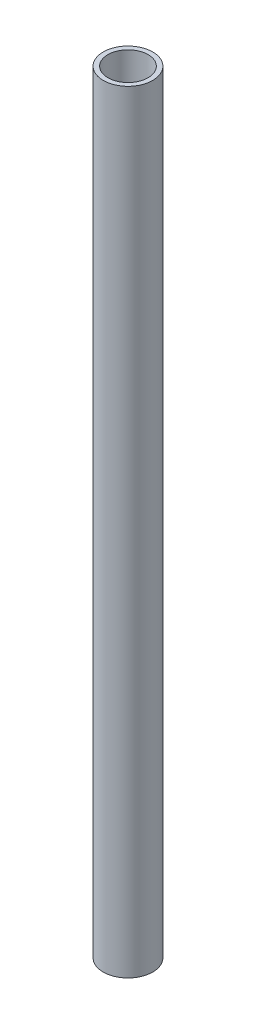
from build123d import *

# Parameters (mm, degrees)
SKETCH1_R           = 8
SKETCH1_R_2         = 6.5
BOSS_EXTRUDE1_DEPTH = 250


with BuildPart() as part:
    # Sketch1 → Boss-Extrude1 (new body)
    with BuildSketch(Plane(origin=(0, 0, 0), x_dir=(1, 0, 0), z_dir=(0, 1, 0))):
        with Locations(Location((0, 0, 0), (0, 0, 270))):
            Circle(SKETCH1_R)
        with Locations(Location((0, 0, 0), (0, 0, 270))):
            Circle(SKETCH1_R_2, mode=Mode.SUBTRACT)
    extrude(amount=BOSS_EXTRUDE1_DEPTH)


solid = part.part
